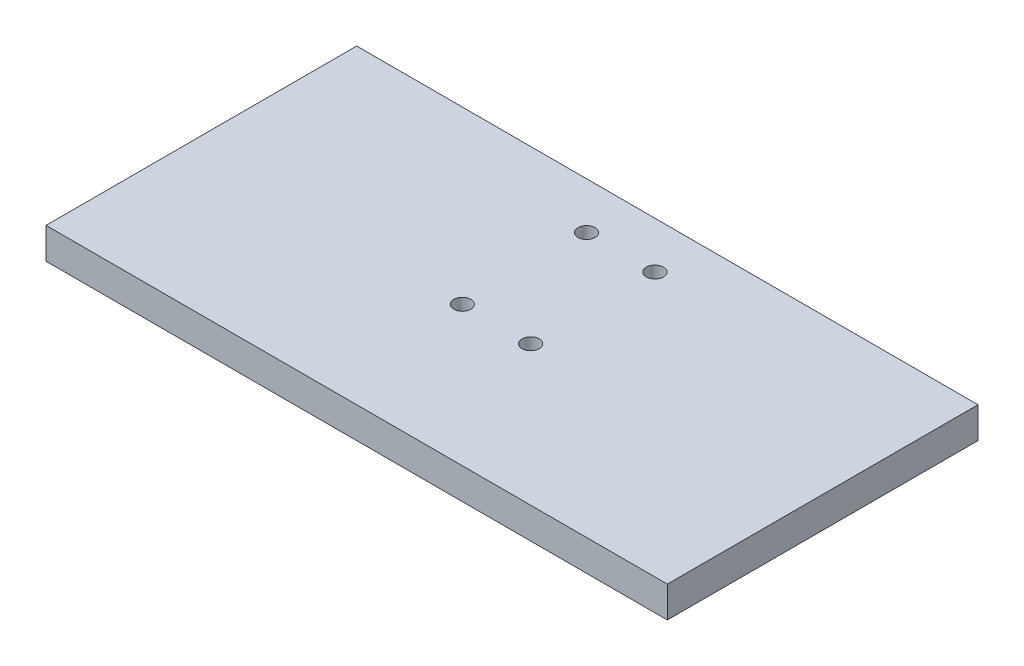
from build123d import *

# Parameters (mm, degrees)
SKETCH_1_W                   = 200
SKETCH_1_H                   = 100
EXTRUDE_1_DEPTH              = 10
HOLE_WIZARD_M5_2_D           = 5.5
HOLE_WIZARD_M5_2_CBORE_D     = 9.5
HOLE_WIZARD_M5_2_CBORE_DEPTH = 3.3


with BuildPart() as part:
    # 스케치1 → 보스-돌출1 (new body)
    with BuildSketch(Plane(origin=(0, 0, 0), x_dir=(1, 0, 0), z_dir=(0, 1, 0))):
        with Locations((100, 50)):
            Rectangle(SKETCH_1_W, SKETCH_1_H)
    extrude(amount=EXTRUDE_1_DEPTH)

    # M5 치즈머리 홈붙이 머리용 카운터보어2 (through all)
    with Locations(Plane(origin=(89, 0, -45), x_dir=(0, 0, -1), z_dir=(0, -1, 0))):
        with Locations((0, 0), (0, 22), (40, 22), (40, 0)):
            CounterBoreHole(HOLE_WIZARD_M5_2_D / 2, HOLE_WIZARD_M5_2_CBORE_D / 2, HOLE_WIZARD_M5_2_CBORE_DEPTH)


solid = part.part
